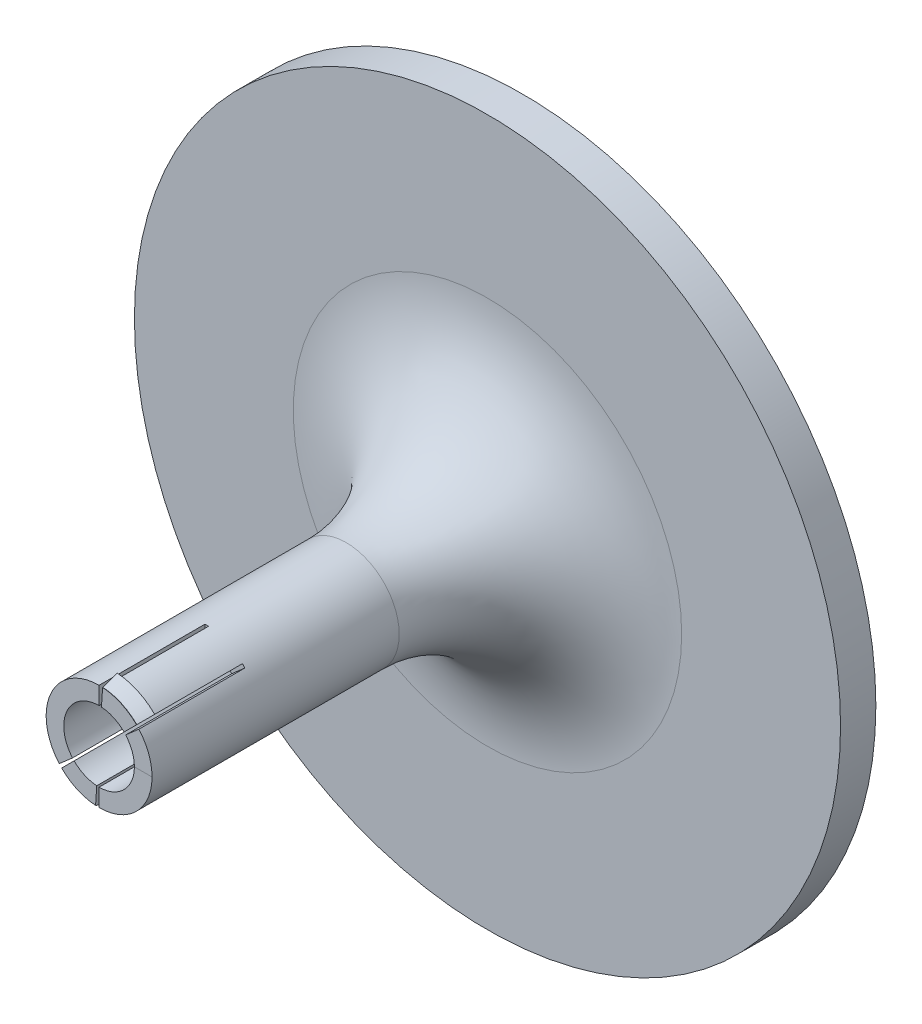
from build123d import *

# Parameters (mm, degrees)
SKETCH_3_R          = 5
CUT_EXTRUDE_1_DEPTH = 93.736184955
CUT_EXTRUDE_2_DEPTH = 15
CUT_EXTRUDE_3_DEPTH = 15
CUT_EXTRUDE_START   = -15
CUT_EXTRUDE_4_DEPTH = 15
CUT_EXTRUDE_5_DEPTH = 15


with BuildPart() as part:
    # 扫描1: sweep along a path in 草图2
    with BuildLine(Plane.XY) as sweep_1_path:
        CenterArc((0, 0), 50, 0, 360)
    # 草图1 → 扫描1 (sweep)
    with BuildSketch(Plane(origin=(0, 0, 0), x_dir=(1, 0, 0), z_dir=(0, 1, 0))):
        with BuildLine():
            Line((0, 0), (7.5, 0))
            Line((7.5, 0), (7.5, 35))
            ThreePointArc((7.5, 35), (13.357864376, 49.142135624), (27.5, 55))
            Line((27.5, 55), (50, 55))
            Line((50, 55), (50, 60))
            Line((50, 60), (0, 60))
            Line((0, 60), (0, 0))
        make_face()
    sweep(path=sweep_1_path.line)

    # 草图3 → 切除-拉伸1 (cut, through all)
    with BuildSketch(Plane.XY):
        Circle(SKETCH_3_R)
    extrude(amount=-CUT_EXTRUDE_1_DEPTH, mode=Mode.SUBTRACT)

    # 草图5 → 切除-拉伸2 (cut)
    with BuildSketch(Plane.XY):
        Polygon((0, 7.5), (0.5, 7.5), (0, 0), align=None)
    extrude(amount=-CUT_EXTRUDE_2_DEPTH, mode=Mode.SUBTRACT)

    # 草图6 → 切除-拉伸3 (cut)
    with BuildSketch(Plane.XY):
        Polygon((0, 0), (5.303300859, 5.303300859), (5.656854249, 4.949747468), align=None)
    extrude(amount=-CUT_EXTRUDE_3_DEPTH, mode=Mode.SUBTRACT)

    # 草图8 → 切除-拉伸4 (cut)
    with BuildSketch(Plane.XY.offset(CUT_EXTRUDE_START)):
        with BuildLine():
            Line((0, 0), (0, -7.5))
            ThreePointArc((0, -7.5), (-0.249584525, -7.495846021), (-0.498892579, -7.483388684))
            Line((-0.498892579, -7.483388684), (0, 0))
        make_face()
    extrude(amount=CUT_EXTRUDE_4_DEPTH, mode=Mode.SUBTRACT)

    # 草图9 → 切除-拉伸5 (cut)
    with BuildSketch(Plane.XY.offset(CUT_EXTRUDE_START)):
        with BuildLine():
            Line((0, 0), (-5.303300859, -5.303300859))
            ThreePointArc((-5.303300859, -5.303300859), (-5.476846462, -5.123880642), (-5.64432521, -4.938784559))
            Line((-5.64432521, -4.938784559), (0, 0))
        make_face()
    extrude(amount=CUT_EXTRUDE_5_DEPTH, mode=Mode.SUBTRACT)

    # 扫描2: sweep along a curve in space
    with BuildLine() as sweep_2_path:
        ThreePointArc((5.303300859, 5.303300859, 0), (3.099122118, 6.829746854, 0), (0.498892579, 7.483388684, 0))
    # 草图10 → 扫描2 (sweep)
    with BuildSketch(Plane(origin=(0, 0, 0), x_dir=(0, 0, 1), z_dir=(-0.997785157856609, 0.06651901052377394, 0))):
        Polygon((0, 7.483388684), (-1.999931015, 7.5), (-1.999931015, 8.3), align=None)
    sweep(path=sweep_2_path.line)

    # 扫描3: sweep along a curve in space
    with BuildLine() as sweep_3_path:
        ThreePointArc((-5.303300859, -5.303300859, 0), (-3.099122118, -6.829746854, 0), (-0.498892579, -7.483388684, 0))
    # 草图11 → 扫描3 (sweep)
    with BuildSketch(Plane(origin=(0, 0, 0), x_dir=(0, 0, -1), z_dir=(0.997785157856609, -0.06651901052377394, 0))):
        Polygon((0, -7.5), (2, -7.5), (2, -8.3), align=None)
    sweep(path=sweep_3_path.line)


solid = part.part
